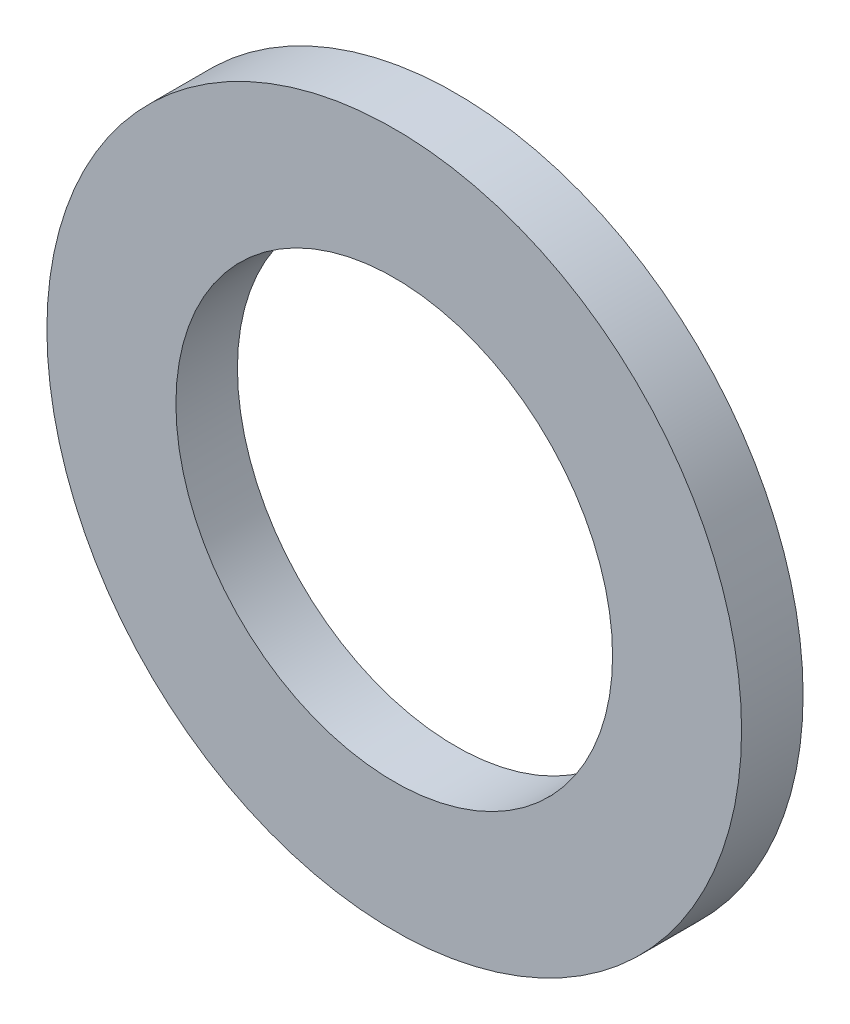
from build123d import *

# Parameters (mm, degrees)
SKETCH1_R           = 175
SKETCH1_R_2         = 110
BOSS_EXTRUDE1_DEPTH = 31


with BuildPart() as part:
    # Sketch1 → Boss-Extrude1 (new body)
    with BuildSketch(Plane.XY):
        Circle(SKETCH1_R)
        Circle(SKETCH1_R_2, mode=Mode.SUBTRACT)
    extrude(amount=BOSS_EXTRUDE1_DEPTH)


solid = part.part
